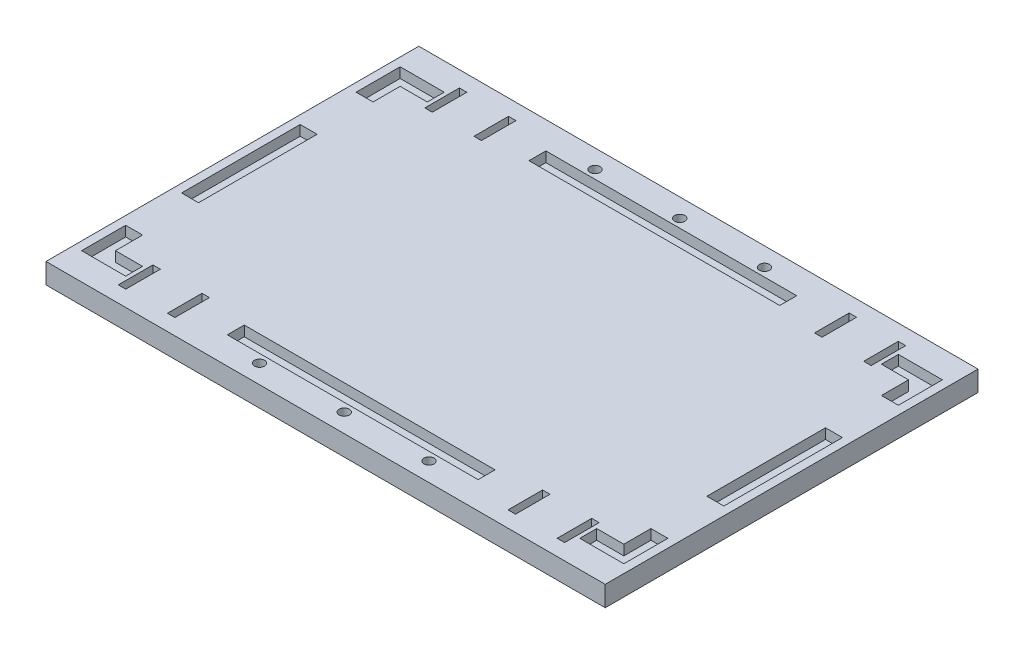
from build123d import *

# Parameters (mm, degrees)
SKETCH1_W           = 165
SKETCH1_H           = 110
BOSS_EXTRUDE1_DEPTH = 6
SKETCH2_W           = 5
SKETCH2_H           = 35
SKETCH2_W_2         = 74
SKETCH2_H_2         = 5
SKETCH2_W_3         = 2.2
SKETCH2_H_3         = 10.2
CUT_EXTRUDE1_DEPTH  = 3
SKETCH3_R           = 1.5
CUT_EXTRUDE2_DEPTH  = 111.956279878


with BuildPart() as part:
    # Sketch1 → Boss-Extrude1 (new body)
    with BuildSketch(Plane(origin=(0, 0, 0), x_dir=(1, 0, 0), z_dir=(0, 1, 0))):
        with Locations((-12.658730159, 1.746031746)):
            Rectangle(SKETCH1_W, SKETCH1_H)
    extrude(amount=BOSS_EXTRUDE1_DEPTH)

    # Sketch2 → Cut-Extrude1 (cut)
    with BuildSketch(Plane(origin=(0, 6, 0), x_dir=(1, 0, 0), z_dir=(0, 1, 0))):
        Polygon((-92.658730159, 48.746031746), (-92.658730159, 35.746031746), (-87.658730159, 35.746031746), (-87.658730159, 43.746031746), (-79.658730159, 43.746031746), (-79.658730159, 48.746031746), align=None)
        Polygon((-79.658730159, -40.253968254), (-79.658730159, -45.253968254), (-92.658730159, -45.253968254), (-92.658730159, -32.253968254), (-87.658730159, -32.253968254), (-87.658730159, -40.253968254), align=None)
        Polygon((54.341269841, 43.746031746), (54.341269841, 48.746031746), (67.341269841, 48.746031746), (67.341269841, 35.746031746), (62.341269841, 35.746031746), (62.341269841, 43.746031746), align=None)
        Polygon((62.341269841, -40.253968254), (54.341269841, -40.253968254), (54.341269841, -45.253968254), (67.341269841, -45.253968254), (67.341269841, -32.253968254), (62.341269841, -32.253968254), align=None)
        with Locations((64.841269841, 1.746031746)):
            Rectangle(SKETCH2_W, SKETCH2_H)
        with Locations((-90.158730159, 1.746031746)):
            Rectangle(SKETCH2_W, SKETCH2_H)
        with Locations((-12.658730159, -42.753968254)):
            Rectangle(SKETCH2_W_2, SKETCH2_H_2)
        with Locations((-12.658730159, 46.246031746)):
            Rectangle(SKETCH2_W_2, SKETCH2_H_2)
        with Locations((-77.408730159, 46.966237914)):
            Rectangle(SKETCH2_W_3, SKETCH2_H_3)
        with Locations((-62.908730159, 46.966237914)):
            Rectangle(SKETCH2_W_3, SKETCH2_H_3)
        with Locations((52.091269841, 46.966237914)):
            Rectangle(SKETCH2_W_3, SKETCH2_H_3)
        with Locations((37.591269841, 46.966237914)):
            Rectangle(SKETCH2_W_3, SKETCH2_H_3)
        with Locations((52.091269841, -43.474174422)):
            Rectangle(SKETCH2_W_3, SKETCH2_H_3)
        with Locations((37.591269841, -43.474174422)):
            Rectangle(SKETCH2_W_3, SKETCH2_H_3)
        with Locations((-62.908730159, -43.474174422)):
            Rectangle(SKETCH2_W_3, SKETCH2_H_3)
        with Locations((-77.408730159, -43.474174422)):
            Rectangle(SKETCH2_W_3, SKETCH2_H_3)
    extrude(amount=-CUT_EXTRUDE1_DEPTH, mode=Mode.SUBTRACT)

    # Sketch3 → Cut-Extrude2 (cut, through all)
    with BuildSketch(Plane(origin=(0, 6, 0), x_dir=(1, 0, 0), z_dir=(0, 1, 0))):
        with Locations(Location((-37.658730159, 51.246031746, 0), (0, 0, 270))):
            Circle(SKETCH3_R)
        with Locations(Location((12.341269841, 51.246031746, 0), (0, 0, 90))):
            Circle(SKETCH3_R)
        with Locations(Location((-12.658730159, 51.246031746, 0), (0, 0, 270))):
            Circle(SKETCH3_R)
        with Locations(Location((12.341269841, -47.753968254, 0), (0, 0, 270))):
            Circle(SKETCH3_R)
        with Locations(Location((-12.658730159, -47.753968254, 0), (0, 0, 90))):
            Circle(SKETCH3_R)
        with Locations(Location((-37.658730159, -47.753968254, 0), (0, 0, 90))):
            Circle(SKETCH3_R)
    extrude(amount=-CUT_EXTRUDE2_DEPTH, mode=Mode.SUBTRACT)


solid = part.part
